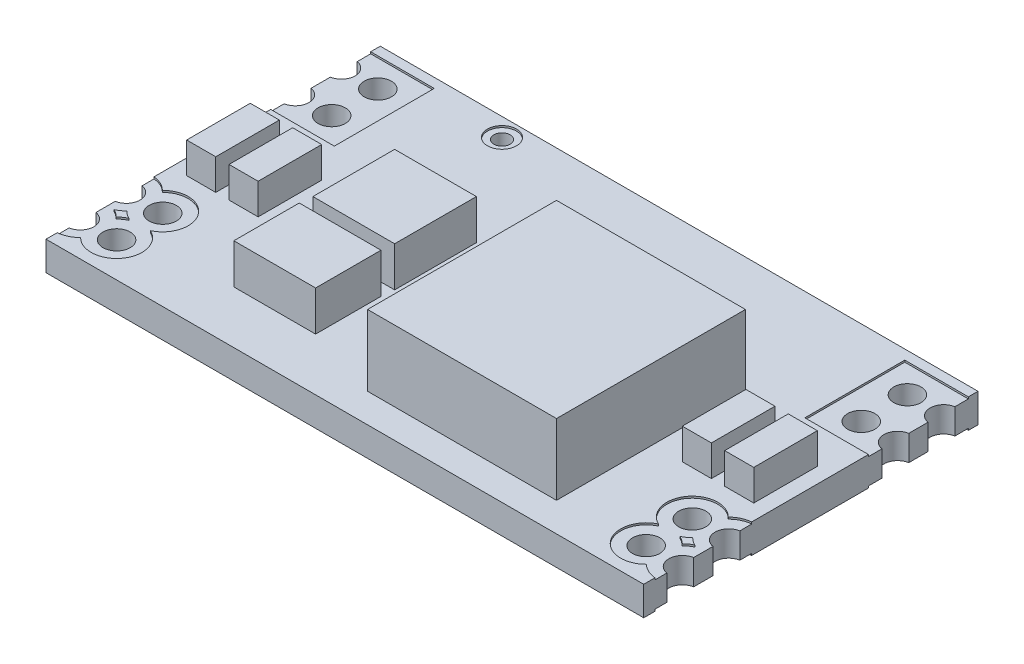
from build123d import *

# Parameters (mm, degrees)
SKETCH1_W           = 32.9
SKETCH1_H           = 18.4
BOSS_EXTRUDE1_DEPTH = 1.6
SKETCH2_R           = 0.75
SKETCH2_R_2         = 0.45
CUT_EXTRUDE4_DEPTH  = 19.915668109
SKETCH4_R           = 0.8
SKETCH4_W           = 3.5
SKETCH4_H           = 5.5
CUT_EXTRUDE5_DEPTH  = 0.1
SKETCH3_W           = 10.4
SKETCH3_H           = 10.4
BOSS_EXTRUDE2_DEPTH = 3.9
SKETCH3_3_W         = 4.5
SKETCH3_3_H         = 4.5
SKETCH3_3_H_2       = 3.6
BOSS_EXTRUDE3_DEPTH = 2.2
SKETCH3_4_W         = 1.6
SKETCH3_4_H         = 3.5
BOSS_EXTRUDE4_DEPTH = 1.7


with BuildPart() as part:
    # Sketch1 → Boss-Extrude1 (new body)
    with BuildSketch(Plane(origin=(0, 0, 0), x_dir=(1, 0, 0), z_dir=(0, 1, 0))):
        Rectangle(SKETCH1_W, SKETCH1_H)
    extrude(amount=BOSS_EXTRUDE1_DEPTH)

    # Sketch2 → Cut-Extrude4 (cut, through all)
    with BuildSketch(Plane(origin=(0, 0, 0), x_dir=(1, 0, 0), z_dir=(0, 1, 0))):
        with Locations((-16.575, 7.19)):
            Circle(SKETCH2_R)
        with Locations((-16.575, 4.65)):
            Circle(SKETCH2_R)
        with Locations((-14.575, 7.19)):
            Circle(SKETCH2_R)
        with Locations((-14.575, 4.65)):
            Circle(SKETCH2_R)
        with Locations((14.575, 4.65)):
            Circle(SKETCH2_R)
        with Locations((14.575, 7.19)):
            Circle(SKETCH2_R)
        with Locations((16.575, 4.65)):
            Circle(SKETCH2_R)
        with Locations((16.575, 7.19)):
            Circle(SKETCH2_R)
        with Locations((16.575, -7.19)):
            Circle(SKETCH2_R)
        with Locations((16.575, -4.65)):
            Circle(SKETCH2_R)
        with Locations((14.575, -7.19)):
            Circle(SKETCH2_R)
        with Locations((14.575, -4.65)):
            Circle(SKETCH2_R)
        with Locations((-14.575, -4.65)):
            Circle(SKETCH2_R)
        with Locations((-14.575, -7.19)):
            Circle(SKETCH2_R)
        with Locations((-16.575, -4.65)):
            Circle(SKETCH2_R)
        with Locations((-16.575, -7.19)):
            Circle(SKETCH2_R)
        with Locations((-8.75, 8.2)):
            Circle(SKETCH2_R_2)
    extrude(amount=CUT_EXTRUDE4_DEPTH, mode=Mode.SUBTRACT)

    # Sketch4 → Cut-Extrude5 (cut)
    # profile 1 of 5: a face of its own
    with BuildSketch(Plane(origin=(0, 1.6, 0), x_dir=(1, 0, 0), z_dir=(0, 1, 0))):
        with Locations((-8.75, 8.2)):
            Circle(SKETCH4_R)
    # profile 2 of 5: a face of its own
    with BuildSketch(Plane(origin=(0, 1.6, 0), x_dir=(1, 0, 0), z_dir=(0, 1, 0))):
        with Locations((-14.7, 5.92)):
            Rectangle(SKETCH4_W, SKETCH4_H)
    # profile 3 of 5: a face of its own
    with BuildSketch(Plane(origin=(0, 1.6, 0), x_dir=(1, 0, 0), z_dir=(0, 1, 0))):
        with Locations((14.7, 5.92)):
            Rectangle(SKETCH4_W, SKETCH4_H)
    # profile 4 of 5: a face of its own
    with BuildSketch(Plane(origin=(0, 1.6, 0), x_dir=(1, 0, 0), z_dir=(0, 1, 0))):
        with BuildLine():
            ThreePointArc((-15.575, -3.670204103), (-17.718500952, -3.842283731), (-17.164151933, -5.92))
            ThreePointArc((-17.164151933, -5.92), (-17.718500952, -7.997716269), (-15.575, -8.169795897))
            ThreePointArc((-15.575, -8.169795897), (-13.431499048, -7.997716269), (-13.985848067, -5.92))
            ThreePointArc((-13.985848067, -5.92), (-13.431499048, -3.842283731), (-15.575, -3.670204103))
        make_face()
        with BuildLine():
            ThreePointArc((-15.575, -5.629795897), (-15.382716269, -5.793500952), (-15.164151933, -5.92))
            ThreePointArc((-15.164151933, -5.92), (-15.382716269, -6.046499048), (-15.575, -6.210204103))
            ThreePointArc((-15.575, -6.210204103), (-15.767283731, -6.046499048), (-15.985848067, -5.92))
            ThreePointArc((-15.985848067, -5.92), (-15.767283731, -5.793500952), (-15.575, -5.629795897))
        make_face(mode=Mode.SUBTRACT)
    # profile 5 of 5: a face of its own
    with BuildSketch(Plane(origin=(0, 1.6, 0), x_dir=(1, 0, 0), z_dir=(0, 1, 0))):
        with BuildLine():
            ThreePointArc((13.985848067, -5.92), (13.431499048, -3.842283731), (15.575, -3.670204103))
            ThreePointArc((15.575, -3.670204103), (17.718500952, -3.842283731), (17.164151933, -5.92))
            ThreePointArc((17.164151933, -5.92), (17.718500952, -7.997716269), (15.575, -8.169795897))
            ThreePointArc((15.575, -8.169795897), (13.431499048, -7.997716269), (13.985848067, -5.92))
        make_face()
        with BuildLine():
            ThreePointArc((15.985848067, -5.92), (15.767283731, -5.793500952), (15.575, -5.629795897))
            ThreePointArc((15.575, -5.629795897), (15.382716269, -5.793500952), (15.164151933, -5.92))
            ThreePointArc((15.164151933, -5.92), (15.382716269, -6.046499048), (15.575, -6.210204103))
            ThreePointArc((15.575, -6.210204103), (15.767283731, -6.046499048), (15.985848067, -5.92))
        make_face(mode=Mode.SUBTRACT)
    cut_extrude5 = extrude(amount=-CUT_EXTRUDE5_DEPTH, mode=Mode.SUBTRACT)

    # Mirror1: Cut-Extrude5 across plane
    add(cut_extrude5.mirror(Plane.ZX.offset(0.8)), mode=Mode.SUBTRACT)

    # Sketch3<3> → Boss-Extrude3 (add)
    with BuildSketch(Plane(origin=(0, 1.6, 0), x_dir=(1, 0, 0), z_dir=(0, 1, 0))):
        with Locations((-6.686728672, 0.226589735)):
            Rectangle(SKETCH3_3_W, SKETCH3_3_H)
        with Locations((-6.75417568, -4.506295327)):
            Rectangle(SKETCH3_3_W, SKETCH3_3_H_2)
    extrude(amount=BOSS_EXTRUDE3_DEPTH)

    # Sketch3<4> → Boss-Extrude4 (add)
    with BuildSketch(Plane(origin=(0, 1.6, 0), x_dir=(1, 0, 0), z_dir=(0, 1, 0))):
        with Locations((12.474888929, -0.55)):
            Rectangle(SKETCH3_4_W, SKETCH3_4_H)
        with Locations((14.806877453, -0.55)):
            Rectangle(SKETCH3_4_W, SKETCH3_4_H)
        with Locations((-14.806877453, -0.55)):
            Rectangle(SKETCH3_4_W, SKETCH3_4_H)
        with Locations((-12.474888929, -0.55)):
            Rectangle(SKETCH3_4_W, SKETCH3_4_H)
    extrude(amount=BOSS_EXTRUDE4_DEPTH)


with BuildPart() as body_2:
    # Sketch3 → Boss-Extrude2 (new body)
    with BuildSketch(Plane(origin=(0, 1.6, 0), x_dir=(1, 0, 0), z_dir=(0, 1, 0))):
        with Locations((4.85, -2.4)):
            Rectangle(SKETCH3_W, SKETCH3_H)
    extrude(amount=BOSS_EXTRUDE2_DEPTH)


solid = Compound([part.part, body_2.part])
